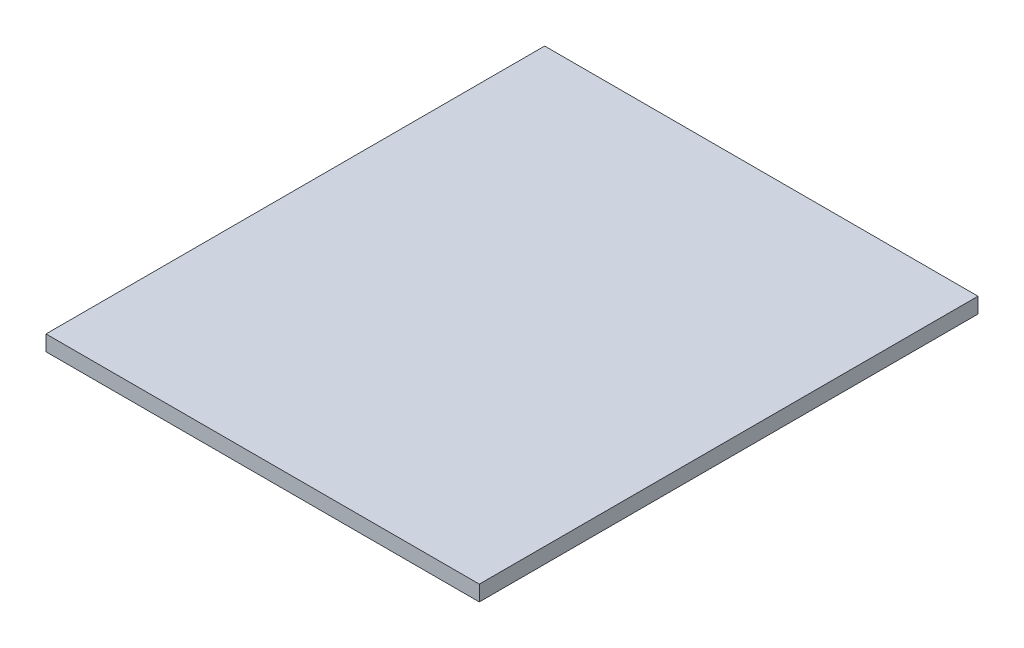
from build123d import *

# Parameters (mm, degrees)
SKETCH1_W           = 126
SKETCH1_H           = 145
BOSS_EXTRUDE1_DEPTH = 4.5


with BuildPart() as part:
    # Sketch1 → Boss-Extrude1 (new body)
    with BuildSketch(Plane(origin=(0, 0, 0), x_dir=(1, 0, 0), z_dir=(0, 1, 0))):
        Rectangle(SKETCH1_W, SKETCH1_H)
    extrude(amount=BOSS_EXTRUDE1_DEPTH)


solid = part.part
